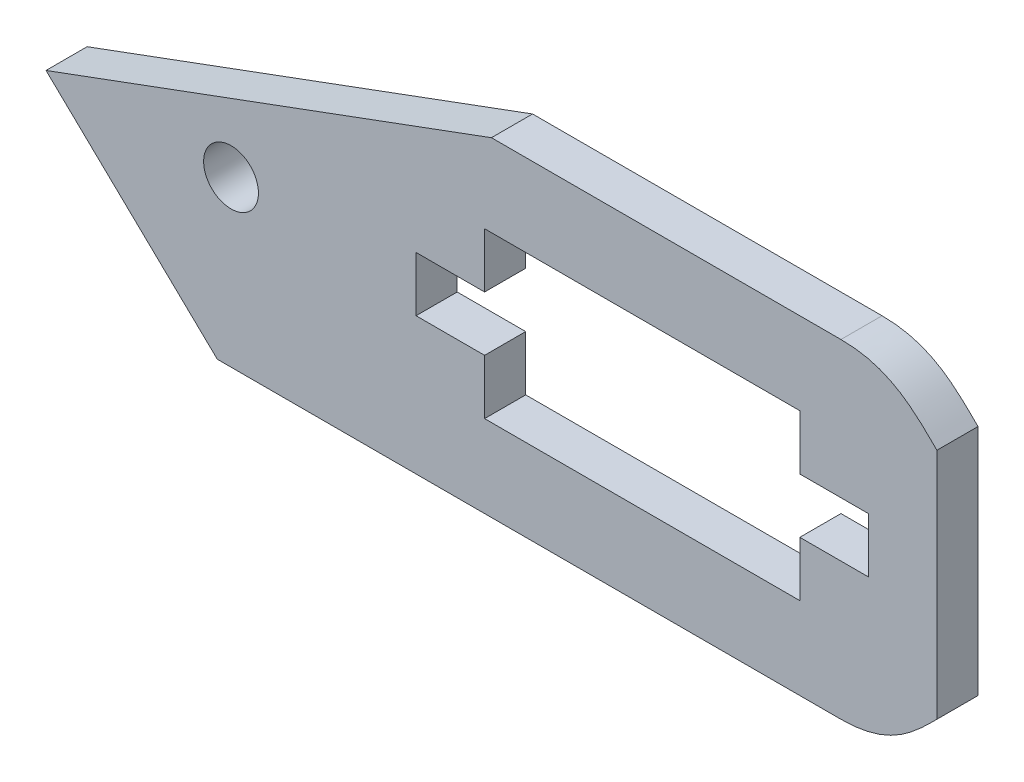
from build123d import *

# Parameters (mm, degrees)
BOSS_EXTRU_1_DEPTH = 3
SKETCH1_R          = 2
CUT_EXTRUDE1_DEPTH = 37.557629685


with BuildPart() as part:
    # Esquisse1 → Boss.-Extru.1 (new body)
    with BuildSketch(Plane.XY):
        with BuildLine():
            Line((-1.901457503, 12), (-34.401457503, 0))
            Line((-34.401457503, 0), (-21.901457503, -12))
            Line((-21.901457503, -12), (23.598542497, -12))
            add(Edge.make_bspline(
                [(23.598542497, -12), (27.098542497, -12), (28.848542497, -10.25), (30.598542497, -8.5)],
                knots=[0, 0, 0, 0, 0.5, 0.5, 0.5, 0.5], degree=3))
            Line((30.598542497, -8.5), (30.598542497, 8.5))
            add(Edge.make_bspline(
                [(23.598542497, 12), (27.098542497, 12), (28.848542497, 10.25), (30.598542497, 8.5)],
                knots=[0, 0, 0, 0, 0.5, 0.5, 0.5, 0.5], degree=3))
            Line((23.598542497, 12), (-1.901457503, 12))
        make_face()
        Polygon((-2.401457503, 2), (-2.401457503, 6), (20.598542497, 6), (20.598542497, 2), (25.598542497, 2), (25.598542497, -2), (20.598542497, -2), (20.598542497, -6), (-2.401457503, -6), (-2.401457503, -2), (-7.401457503, -2), (-7.401457503, 2), align=None, mode=Mode.SUBTRACT)
    extrude(amount=BOSS_EXTRU_1_DEPTH)

    # Sketch1 → Cut-Extrude1 (cut, through all)
    with BuildSketch(Plane.XY.offset(3)):
        with Locations((-20.901457503, 0)):
            Circle(SKETCH1_R)
    extrude(amount=-CUT_EXTRUDE1_DEPTH, mode=Mode.SUBTRACT)


solid = part.part
